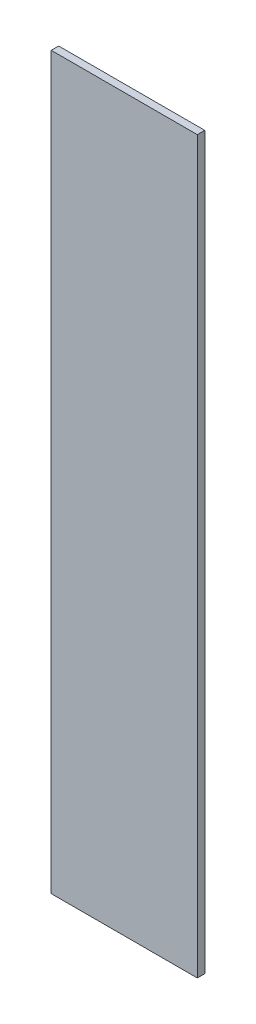
from build123d import *

# Parameters (mm, degrees)
SKETCH1_W           = 0.255
SKETCH1_H           = 25
BOSS_EXTRUDE1_DEPTH = 2.5


with BuildPart() as part:
    # Sketch1 → Boss-Extrude1 (new, symmetric)
    with BuildSketch(Plane(origin=(0, 0, 0), x_dir=(0, 0, -1), z_dir=(1, 0, 0))):
        with Locations((-0.1275, 12.5)):
            Rectangle(SKETCH1_W, SKETCH1_H)
    extrude(amount=BOSS_EXTRUDE1_DEPTH, both=True)


solid = part.part
